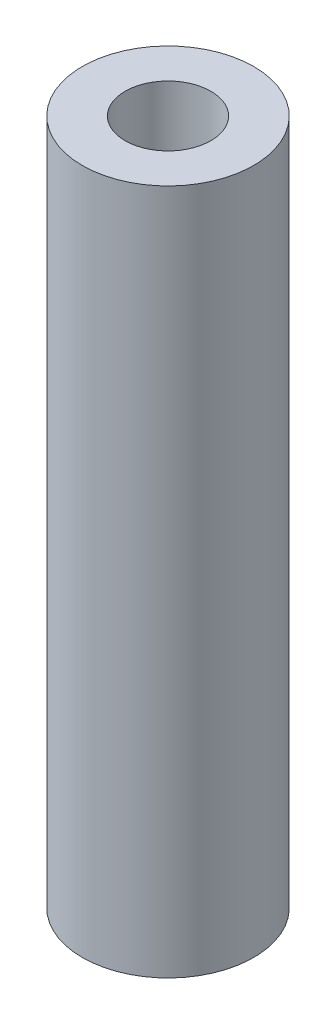
from build123d import *

# Parameters (mm, degrees)
SKETCH1_R           = 3.175
SKETCH1_R_2         = 1.5875
BOSS_EXTRUDE1_DEPTH = 25.4


with BuildPart() as part:
    # Sketch1 → Boss-Extrude1 (new body)
    with BuildSketch(Plane(origin=(0, 0, 0), x_dir=(1, 0, 0), z_dir=(0, 1, 0))):
        with Locations(Location((0, 0, 0), (0, 0, 270))):
            Circle(SKETCH1_R)
        with Locations(Location((0, 0, 0), (0, 0, 270))):
            Circle(SKETCH1_R_2, mode=Mode.SUBTRACT)
    extrude(amount=BOSS_EXTRUDE1_DEPTH)


solid = part.part
